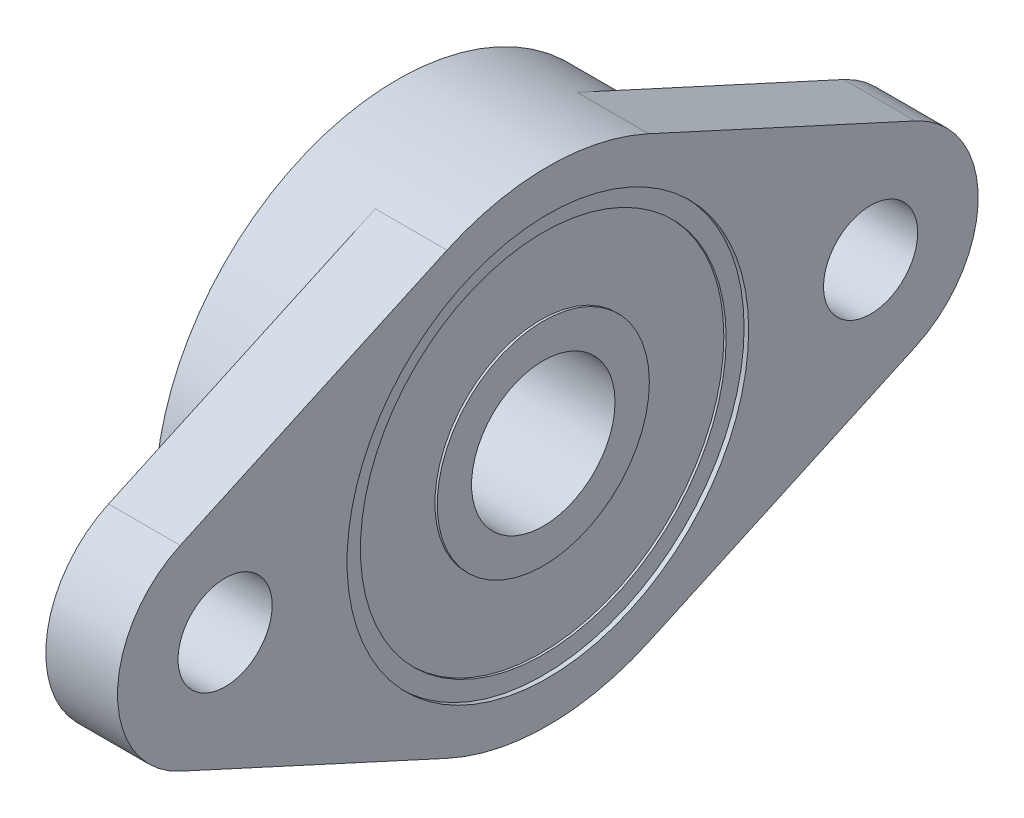
from build123d import *

# Parameters (mm, degrees)
SKETCH4_R           = 11.2
SKETCH4_R_2         = 2.625
BOSS_EXTRUDE3_DEPTH = 4


with BuildPart() as part:
    # Sketch2 → Revolve1 (revolve)
    with BuildSketch(Plane(origin=(0, 0, 0), x_dir=(1, 0, 0), z_dir=(0, 1, 0))):
        Polygon((-0.255431619, 4), (-11.7, 4), (-11.7, 5.915), (-7.678354549, 5.915), (-7.678354549, 10.2), (-7.915390692, 10.2), (-7.915390692, 11.2), (-8.1271402, 11.2), (-8.4, 11.4728598), (-8.4, 13.5), (0, 13.5), (0, 11.2), (-0.255431619, 11.2), (-0.255431619, 10.2), (-0.384561477, 10.2), (-0.384561477, 5.915), (-0.255431619, 5.915), align=None)
    revolve(axis=Axis((0, 0, 0), (-1, 0, 0)))

    # Sketch4 → Boss-Extrude3 (add)
    with BuildSketch(Plane(origin=(0, 0, 0), x_dir=(0, 0, -1), z_dir=(1, 0, 0))):
        with BuildLine():
            ThreePointArc((20.5, 5.454356057), (24, 0), (20.5, -5.454356057))
            Line((20.5, -5.454356057), (5.625, -12.272301129))
            ThreePointArc((5.625, -12.272301129), (0, -13.5), (-5.625, -12.272301129))
            Line((-5.625, -12.272301129), (-20.5, -5.454356057))
            ThreePointArc((-20.5, -5.454356057), (-24, 0), (-20.5, 5.454356057))
            Line((-20.5, 5.454356057), (-5.625, 12.272301129))
            ThreePointArc((-5.625, 12.272301129), (0, 13.5), (5.625, 12.272301129))
            Line((5.625, 12.272301129), (20.5, 5.454356057))
        make_face()
        Circle(SKETCH4_R, mode=Mode.SUBTRACT)
        with Locations((-18, 0)):
            Circle(SKETCH4_R_2, mode=Mode.SUBTRACT)
        with Locations((18, 0)):
            Circle(SKETCH4_R_2, mode=Mode.SUBTRACT)
    extrude(amount=-BOSS_EXTRUDE3_DEPTH)


solid = part.part
